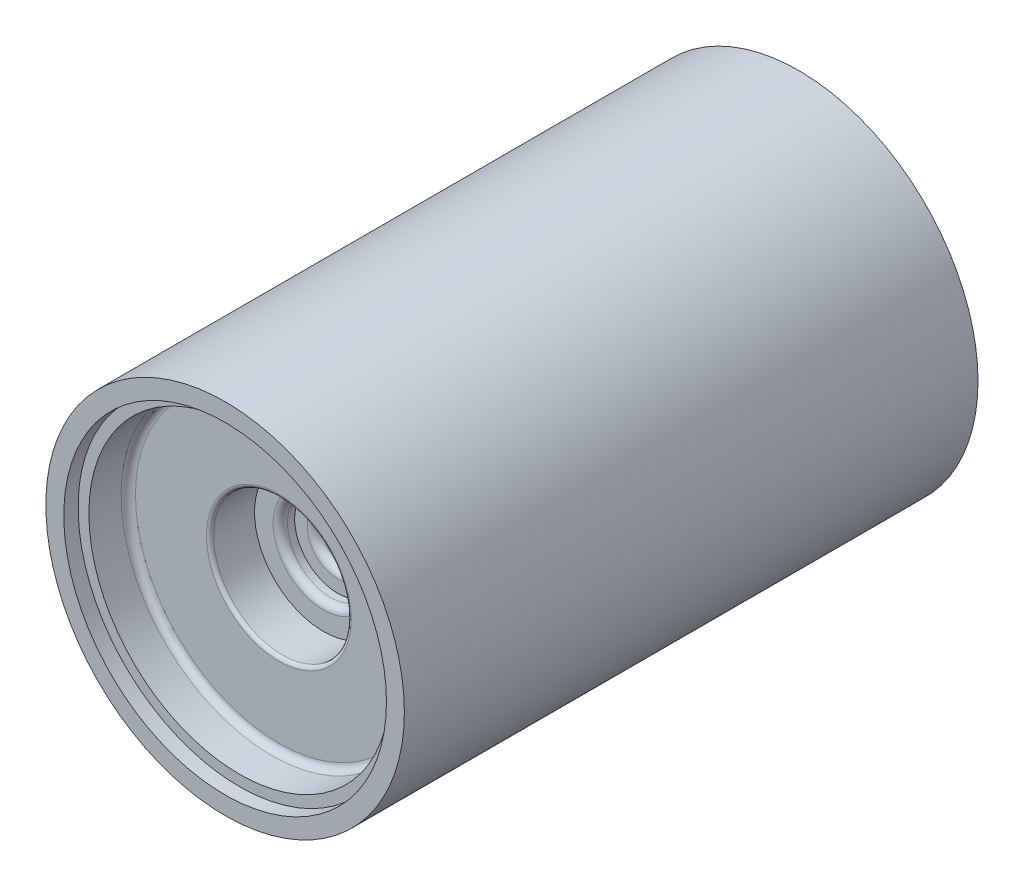
from build123d import *

# Parameters (mm, degrees)
ESBO_O1_R                = 25
ESBO_O1_R_2              = 3.25
RESSALTO_EXTRUS_O1_DEPTH = 40
FILETE2_R                = 1
ESBO_O6_R                = 21
CORTE_EXTRUS_O3_DEPTH    = 7.5
CORTE_EXTRUS_O4_START    = -7.5
ESBO_O7_R                = 21
CORTE_EXTRUS_O4_DEPTH    = 7.5
ESBO_O3_R                = 9.6
CORTE_EXTRUS_O1_DEPTH    = 6.2
CORTE_EXTRUS_O2_START    = -6.2
ESBO_O4_R                = 9.6
CORTE_EXTRUS_O2_DEPTH    = 6.2
FILETE3_R                = 0.5
FILETE4_R                = 1
CORTE_EXTRUS_O5_START    = -2
ESBO_O8_R                = 22.5
ESBO_O8_R_2              = 21
CORTE_EXTRUS_O5_DEPTH    = 2
ESBO_O9_R                = 22.5
ESBO_O9_R_2              = 21
CORTE_EXTRUS_O6_DEPTH    = 2
ESBO_O10_R               = 6
CORTE_EXTRUS_O7_DEPTH    = 2
CORTE_EXTRUS_O8_START    = -2
ESBO_O12_R               = 6
CORTE_EXTRUS_O8_DEPTH    = 2
FILETE5_R                = 1


with BuildPart() as part:
    # Esboço1 → Ressalto-extrusão1 (new, symmetric)
    with BuildSketch(Plane.XY):
        Circle(ESBO_O1_R)
        Circle(ESBO_O1_R_2, mode=Mode.SUBTRACT)
    extrude(amount=RESSALTO_EXTRUS_O1_DEPTH, both=True)

    # Filete2
    filete2_edges = [part.edges().sort_by_distance(p)[0] for p in [
        (-3.25, 0, -40),
        (-3.25, 0, 40),
    ]]
    fillet(filete2_edges, radius=FILETE2_R)

    # Esboço6 → Corte-extrusão3 (cut)
    with BuildSketch(Plane(origin=(0, 0, -40), x_dir=(-1, 0, 0), z_dir=(0, 0, -1))):
        Circle(ESBO_O6_R)
    extrude(amount=-CORTE_EXTRUS_O3_DEPTH, mode=Mode.SUBTRACT)

    # Esboço7 → Corte-extrusão4 (cut)
    with BuildSketch(Plane.XY.offset(40).offset(CORTE_EXTRUS_O4_START)):
        with Locations(Location((0, 0, 0), (0, 0, 180))):
            Circle(ESBO_O7_R)
    extrude(amount=CORTE_EXTRUS_O4_DEPTH, mode=Mode.SUBTRACT)

    # Esboço3 → Corte-extrusão1 (cut)
    with BuildSketch(Plane.XY.offset(32.5)):
        Circle(ESBO_O3_R)
    extrude(amount=-CORTE_EXTRUS_O1_DEPTH, mode=Mode.SUBTRACT)

    # Esboço4 → Corte-extrusão2 (cut)
    with BuildSketch(Plane(origin=(0, 0, -32.5), x_dir=(-1, 0, 0), z_dir=(0, 0, -1)).offset(CORTE_EXTRUS_O2_START)):
        with Locations(Location((0, 0, 0), (0, 0, 180))):
            Circle(ESBO_O4_R)
    extrude(amount=CORTE_EXTRUS_O2_DEPTH, mode=Mode.SUBTRACT)

    # Filete3
    filete3_edges = [part.edges().sort_by_distance(p)[0] for p in [
        (-9.6, 0, 32.5),
        (-9.6, 0, -32.5),
    ]]
    fillet(filete3_edges, radius=FILETE3_R)

    # Filete4
    filete4_edges = [part.edges().sort_by_distance(p)[0] for p in [
        (21, 0, -32.5),
        (21, 0, 32.5),
        (-3.25, 0, 26.3),
        (-3.25, 0, -26.3),
    ]]
    fillet(filete4_edges, radius=FILETE4_R)

    # Esboço8 → Corte-extrusão5 (cut)
    with BuildSketch(Plane.XY.offset(40).offset(CORTE_EXTRUS_O5_START)):
        Circle(ESBO_O8_R)
        Circle(ESBO_O8_R_2, mode=Mode.SUBTRACT)
    extrude(amount=CORTE_EXTRUS_O5_DEPTH, mode=Mode.SUBTRACT)

    # Esboço9 → Corte-extrusão6 (cut)
    with BuildSketch(Plane(origin=(0, 0, -40), x_dir=(-1, 0, 0), z_dir=(0, 0, -1))):
        with Locations(Location((0, 0, 0), (0, 0, 180))):
            Circle(ESBO_O9_R)
        Circle(ESBO_O9_R_2, mode=Mode.SUBTRACT)
    extrude(amount=-CORTE_EXTRUS_O6_DEPTH, mode=Mode.SUBTRACT)

    # Esboço10 → Corte-extrusão7 (cut)
    with BuildSketch(Plane.XY.offset(26.3)):
        Circle(ESBO_O10_R)
    extrude(amount=-CORTE_EXTRUS_O7_DEPTH, mode=Mode.SUBTRACT)

    # Esboço12 → Corte-extrusão8 (cut)
    with BuildSketch(Plane(origin=(0, 0, -26.3), x_dir=(-1, 0, 0), z_dir=(0, 0, -1)).offset(CORTE_EXTRUS_O8_START)):
        with Locations(Location((0, 0, 0), (0, 0, 180))):
            Circle(ESBO_O12_R)
    extrude(amount=CORTE_EXTRUS_O8_DEPTH, mode=Mode.SUBTRACT)

    # Filete5
    filete5_edges = [part.edges().sort_by_distance(p)[0] for p in [
        (-6, 0, 26.3),
        (-3.25, 0, 24.3),
        (-6, 0, -26.3),
        (-3.25, 0, -24.3),
    ]]
    fillet(filete5_edges, radius=FILETE5_R)


solid = part.part
